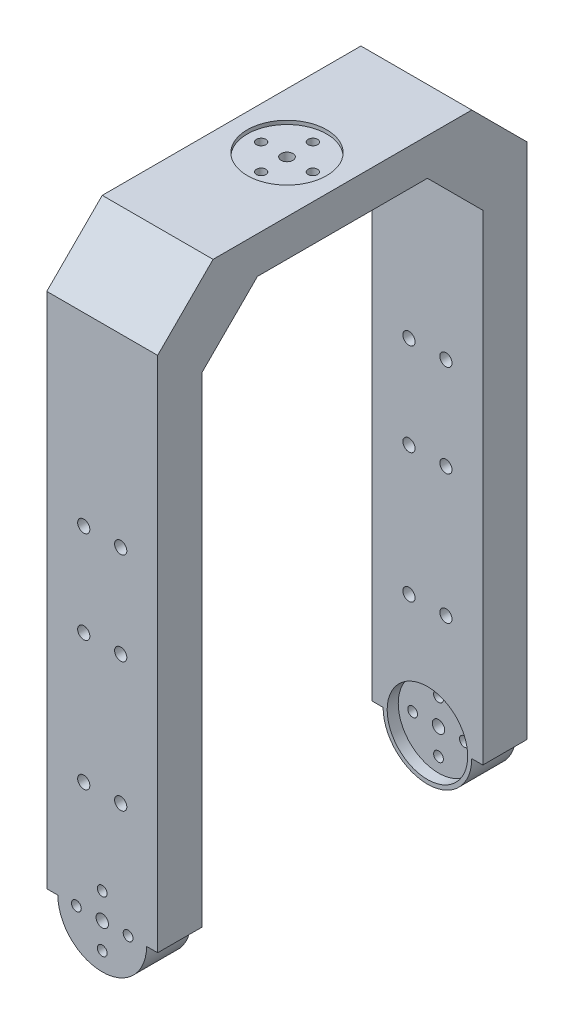
from build123d import *

# Parameters (mm, degrees)
SKETCH_1_R          = 12
SKETCH_1_W          = 30
SKETCH_1_H          = 145
EXTRUDE_1_DEPTH     = 12
SKETCH_2_W          = 30
SKETCH_2_H          = 50
EXTRUDE_2_DEPTH     = 10
SKETCH_3_R          = 10.9
CUT_EXTRUDE_1_DEPTH = 3
SKETCH_4_R          = 1.675
CUT_EXTRUDE_2_DEPTH = 18
CHAMFER_1_SIZE      = 15
SKETCH_5_R          = 10.75
CUT_EXTRUDE_3_DEPTH = 1
SKETCH_8_R          = 1.6
CUT_EXTRUDE_4_DEPTH = 14
SKETCH_9_R          = 1.325
CUT_EXTRUDE_5_DEPTH = 120
SKETCH_10_R         = 1.275
CUT_EXTRUDE_6_DEPTH = 120
SKETCH_11_R         = 1.65
CUT_EXTRUDE_7_DEPTH = 130
SKETCH_12_R         = 1.65
CUT_EXTRUDE_8_DEPTH = 120


with BuildPart() as part:
    # 草图1 → 凸台-拉伸1 (new body)
    with BuildSketch(Plane.XY.offset(38)):
        Circle(SKETCH_1_R)
        with Locations((0, 72.5)):
            Rectangle(SKETCH_1_W, SKETCH_1_H)
        with BuildLine():
            ThreePointArc((12, 0), (0, 12), (-12, 0))
            Line((-12, 0), (12, 0))
        make_face()
        with BuildLine():
            Line((12, 0), (-12, 0))
            ThreePointArc((-12, 0), (0, -12), (12, 0))
        make_face()
    extrude_1 = extrude(amount=EXTRUDE_1_DEPTH)

    # 草图2 → 凸台-拉伸2 (add)
    with BuildSketch(Plane(origin=(0, 145, 0), x_dir=(1, 0, 0), z_dir=(0, 1, 0))):
        with Locations((0, -25)):
            Rectangle(SKETCH_2_W, SKETCH_2_H)
    extrude_2 = extrude(amount=EXTRUDE_2_DEPTH)

    # 草图3 → 切除-拉伸1 (cut)
    with BuildSketch(Plane(origin=(0, 0, 38), x_dir=(-1, 0, 0), z_dir=(0, 0, -1))):
        Circle(SKETCH_3_R)
    cut_extrude_1 = extrude(amount=-CUT_EXTRUDE_1_DEPTH, mode=Mode.SUBTRACT)

    # 草图4 → 切除-拉伸2 (cut, symmetric)
    with BuildSketch(Plane(origin=(0, 0, 41), x_dir=(-1, 0, 0), z_dir=(0, 0, -1))):
        Circle(SKETCH_4_R)
    cut_extrude_2 = extrude(amount=CUT_EXTRUDE_2_DEPTH, both=True, mode=Mode.SUBTRACT)

    # 镜向1: 凸台-拉伸2 across plane
    add(extrude_2.mirror(Plane.XY))

    # 镜向2: 凸台-拉伸1, 切除-拉伸1, 切除-拉伸2 across plane
    add(extrude_1.mirror(Plane.XY))
    add(cut_extrude_1.mirror(Plane.XY), mode=Mode.SUBTRACT)
    add(cut_extrude_2.mirror(Plane.XY), mode=Mode.SUBTRACT)

    # 倒角1
    chamfer_1_edges = [part.edges().sort_by_distance(p)[0] for p in [
        (0, 155, 50),
        (0, 155, -50),
        (0, 145, -38),
        (0, 145, 38),
    ]]
    chamfer(chamfer_1_edges, length=CHAMFER_1_SIZE)

    # 草图5 → 切除-拉伸3 (cut)
    with BuildSketch(Plane(origin=(0, 155, 0), x_dir=(1, 0, 0), z_dir=(0, 1, 0))):
        with Locations(Location((0, 0, 0), (0, 0, 180))):
            Circle(SKETCH_5_R)
    extrude(amount=-CUT_EXTRUDE_3_DEPTH, mode=Mode.SUBTRACT)

    # 草图8 → 切除-拉伸4 (cut)
    with BuildSketch(Plane(origin=(0, 154, 0), x_dir=(1, 0, 0), z_dir=(0, 1, 0))):
        with Locations(Location((0, 0, 0), (0, 0, 180))):
            Circle(SKETCH_8_R)
    extrude(amount=-CUT_EXTRUDE_4_DEPTH, mode=Mode.SUBTRACT)

    # 草图9 → 切除-拉伸5 (cut)
    with BuildSketch(Plane.XY.offset(50)):
        with Locations((-7, 0)):
            Circle(SKETCH_9_R)
        with Locations((0, 7)):
            Circle(SKETCH_9_R)
        with Locations((7, 0)):
            Circle(SKETCH_9_R)
        with Locations((0, -7)):
            Circle(SKETCH_9_R)
    extrude(amount=-CUT_EXTRUDE_5_DEPTH, mode=Mode.SUBTRACT)

    # 草图10 → 切除-拉伸6 (cut)
    with BuildSketch(Plane(origin=(0, 155, 0), x_dir=(1, 0, 0), z_dir=(0, 1, 0))):
        with Locations(Location((-7, 0, 0), (0, 0, 180))):
            Circle(SKETCH_10_R)
        with Locations(Location((0, 7, 0), (0, 0, 180))):
            Circle(SKETCH_10_R)
        with Locations(Location((7, 0, 0), (0, 0, 180))):
            Circle(SKETCH_10_R)
        with Locations(Location((0, -7, 0), (0, 0, 180))):
            Circle(SKETCH_10_R)
    extrude(amount=-CUT_EXTRUDE_6_DEPTH, mode=Mode.SUBTRACT)

    # 草图11 → 切除-拉伸7 (cut)
    with BuildSketch(Plane.XY.offset(50)):
        with Locations(Location((-5, 30, 0), (0, 0, 180))):
            Circle(SKETCH_11_R)
        with Locations(Location((5, 30, 0), (0, 0, 180))):
            Circle(SKETCH_11_R)
        with Locations(Location((-5, 90, 0), (0, 0, 180))):
            Circle(SKETCH_11_R)
        with Locations(Location((5, 90, 0), (0, 0, 180))):
            Circle(SKETCH_11_R)
    extrude(amount=-CUT_EXTRUDE_7_DEPTH, mode=Mode.SUBTRACT)

    # 草图12 → 切除-拉伸8 (cut)
    with BuildSketch(Plane.XY.offset(50)):
        with Locations(Location((-5, 65, 0), (0, 0, 180))):
            Circle(SKETCH_12_R)
        with Locations(Location((5, 65, 0), (0, 0, 180))):
            Circle(SKETCH_12_R)
    extrude(amount=-CUT_EXTRUDE_8_DEPTH, mode=Mode.SUBTRACT)


solid = part.part
